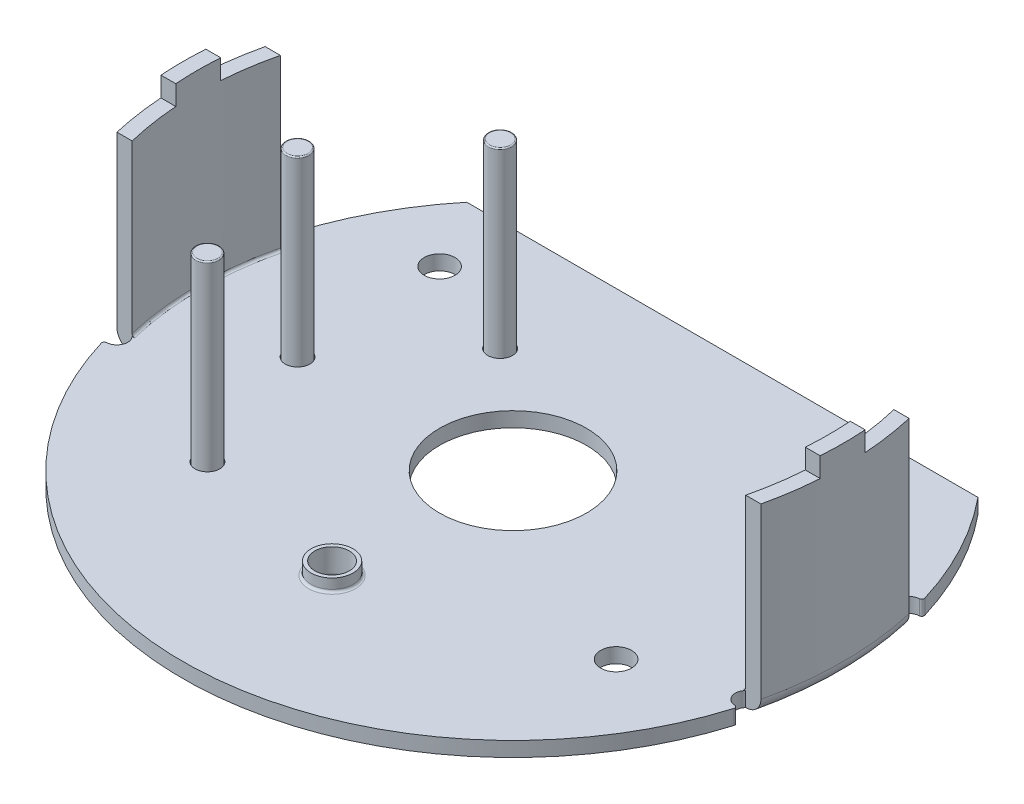
from build123d import *

# Parameters (mm, degrees)
SKETCH_1_R          = 13.375
EXTRUDE_1_DEPTH     = 7.85
SHELL_1_T           = -0.6
CUT_EXTRUDE_1_REACH = 22.479
CUT_EXTRUDE_2_DEPTH = 7.25
CUT_EXTRUDE_START   = -0.6
CUT_EXTRUDE_3_DEPTH = 0.6
FILLET_1_R          = 0.1
FILLET_2_R          = 0.6
FILLET_3_R          = 0.1
SKETCH_5_R          = 2.975
SKETCH_5_R_2        = 0.6250000000000007
SKETCH_5_R_3        = 0.5000000000000009
SKETCH_5_R_4        = 0.5000000000000008
SKETCH_5_R_5        = 0.5000000000000017
SKETCH_5_R_6        = 0.7
CUT_EXTRUDE_4_DEPTH = 0.6
SKETCH_6_R          = 1.1
CUT_EXTRUDE_5_DEPTH = 0.1
SKETCH_7_R          = 0.47499999999999953
EXTRUDE_2_DEPTH     = 7.95
SKETCH_7_R_2        = 0.47500000000000037
EXTRUDE_2_2_DEPTH   = 7.95
SKETCH_7_R_3        = 0.47499999999999964
EXTRUDE_2_3_DEPTH   = 7.95
FILLET_4_R          = 0.05
FILLET_5_R          = 0.05
FILLET_6_R          = 0.05
SKETCH_8_W          = 26.750000000000004
SKETCH_8_H          = 2.19
CUT_EXTRUDE_6_DEPTH = 0.4
EXTRUDE_3_DEPTH     = 0.4
EXTRUDE_START       = 0.5
SKETCH_10_R         = 0.8499999999999993
SKETCH_10_R_2       = 0.6999999999999993
EXTRUDE_4_DEPTH     = 0.5
FILLET_7_R          = 0.15
FILLET_8_R          = 0.1


with BuildPart() as part:
    # Эскиз1 → Бобышка-Вытянуть1 (new body)
    with BuildSketch(Plane(origin=(0, 0, 0), x_dir=(1, 0, 0), z_dir=(0, 1, 0))):
        with Locations(Location((0, 0, 0), (0, 0, 270))):
            Circle(SKETCH_1_R)
    extrude(amount=EXTRUDE_1_DEPTH)

    # Оболочка1
    shell_1_openings = [part.faces().sort_by_distance(p)[0] for p in [
        (0, 7.85, 0),
    ]]
    offset(amount=SHELL_1_T, openings=shell_1_openings, kind=Kind.INTERSECTION)

    # Вырез-Вытянуть1: up to this face of the body (flat: up to its plane)
    cut_extrude_1_end = Plane(part.part.faces().sort_by_distance((0, 0, 0))[0])
    # Эскиз2 → Вырез-Вытянуть1 (cut, up to the picked face)
    with BuildSketch(Plane(origin=(0, 7.85, 0), x_dir=(1, 0, 0), z_dir=(0, 1, 0)), mode=Mode.PRIVATE) as cut_extrude_1_sk1:
        Polygon((-13.375, 14), (13.375, 14.000000000000004), (13.375000000000002, 8.475000000000001), (-13.375000000000002, 8.474999999999998), align=None)
    cut_extrude_1_tool1 = split(extrude(cut_extrude_1_sk1.sketch, amount=-CUT_EXTRUDE_1_REACH, mode=Mode.PRIVATE), bisect_by=cut_extrude_1_end, keep=Keep.BOTH, mode=Mode.PRIVATE)
    add(cut_extrude_1_tool1.solids().sort_by(Axis((0, 7.85, -11.2375), (0, -1, 0)))[0], mode=Mode.SUBTRACT)

    # Эскиз3 → Вырез-Вытянуть2 (cut)
    with BuildSketch(Plane(origin=(0, 7.85, 0), x_dir=(1, 0, 0), z_dir=(0, 1, 0))):
        Polygon((-13.375000000000002, 9.474999999999998), (13.375000000000002, 9.475000000000001), (13.374999999999998, 3.0000000000000036), (-13.374999999999998, 3), align=None)
        Polygon((-13.374999999999998, -3), (13.374999999999998, -2.9999999999999964), (13.375, -14.374999999999995), (-13.374999999999996, -14.374999999999998), align=None)
    extrude(amount=-CUT_EXTRUDE_2_DEPTH, mode=Mode.SUBTRACT)

    # Эскиз4 → Вырез-Вытянуть3 (cut)
    with BuildSketch(Plane(origin=(0, 0.6, 0), x_dir=(1, 0, 0), z_dir=(0, 1, 0)).offset(CUT_EXTRUDE_START)):
        with BuildLine():
            Line((-13.034209795764374, -3), (-12.417754426626418, -3))
            ThreePointArc((-12.417754426626418, -3), (-12.359474669780546, -3.5229744066257926), (-12.846906012793687, -3.72124050532151))
            ThreePointArc((-12.846906012793687, -3.72124050532151), (-12.945581711171867, -3.3619249187589606), (-13.034209795764374, -3))
        make_face()
        with BuildLine():
            Line((-13.034209795764374, 3), (-12.417754426626418, 3))
            ThreePointArc((-12.417754426626418, 3), (-12.359474669780546, 3.5229744066257926), (-12.846906012793687, 3.7212405053215094))
            ThreePointArc((-12.846906012793687, 3.7212405053215094), (-12.94558171117187, 3.3619249187589615), (-13.034209795764374, 3))
        make_face()
    cut_extrude_3 = extrude(amount=CUT_EXTRUDE_3_DEPTH, mode=Mode.SUBTRACT)

    # Зеркальное отражение1: Вырез-Вытянуть3 across plane
    add(cut_extrude_3.mirror(Plane(origin=(0, 0, 0), x_dir=(0, 0, 1), z_dir=(1, 0, 0))), mode=Mode.SUBTRACT)

    # Скругление1
    fillet_1_edges = [part.edges().sort_by_distance(p)[0] for p in [
        (12.846906012793685, 0.3, -3.7212405053215094),
        (12.846906012793688, 0.3, 3.7212405053215107),
        (-12.846906012793685, 0.3, -3.7212405053215094),
        (-12.846906012793688, 0.3, 3.7212405053215107),
    ]]
    fillet(fillet_1_edges, radius=FILLET_1_R)

    # Скругление2
    fillet_2_edges = [part.edges().sort_by_distance(p)[0] for p in [
        (-13.375, 0, 0),
        (13.375, 0, -5.33e-15),
    ]]
    fillet(fillet_2_edges, radius=FILLET_2_R)

    # Скругление3
    fillet_3_edges = [part.edges().sort_by_distance(p)[0] for p in [
        (-12.775, 0.6, 6.306e-14),
        (12.775, 0.6, 5.596e-14),
    ]]
    fillet(fillet_3_edges, radius=FILLET_3_R)

    # Эскиз5 → Вырез-Вытянуть4 (cut)
    with BuildSketch(Plane(origin=(0, 0.6, 0), x_dir=(1, 0, 0), z_dir=(0, 1, 0))):
        with Locations(Location((0, 0, 0), (0, 0, 270))):
            Circle(SKETCH_5_R)
        with Locations(Location((-8.64722184936614, 5.674999999999998, 0), (0, 0, 270))):
            Circle(SKETCH_5_R_2)
        with Locations(Location((-4.5472218493661405, 4.024999999999999, 0), (0, 0, 270))):
            Circle(SKETCH_5_R_3)
        with Locations(Location((-8.34722184936614, -0.37500000000000205, 0), (0, 0, 270))):
            Circle(SKETCH_5_R_4)
        with Locations(Location((-6.49722184936614, -5.875000000000002, 0), (0, 0, 270))):
            Circle(SKETCH_5_R_5)
        with Locations(Location((0, -7.325000000000004, 0), (0, 0, 270))):
            Circle(SKETCH_5_R_6)
        with Locations(Location((8.697221849366136, -4.525000000000001, 0), (0, 0, 270))):
            Circle(SKETCH_5_R_2)
    extrude(amount=-CUT_EXTRUDE_4_DEPTH, mode=Mode.SUBTRACT)

    # Эскиз6 → Вырез-Вытянуть5 (cut)
    with BuildSketch(Plane.XZ):
        with Locations(Location((-6.49722184936614, 5.875000000000002, 0), (0, 0, 270))):
            Circle(SKETCH_6_R)
        with Locations(Location((-8.34722184936614, 0.37500000000000205, 0), (0, 0, 270))):
            Circle(SKETCH_6_R)
        with Locations(Location((-4.5472218493661405, -4.024999999999999, 0), (0, 0, 270))):
            Circle(SKETCH_6_R)
    extrude(amount=-CUT_EXTRUDE_5_DEPTH, mode=Mode.SUBTRACT)

    # Эскиз8 → Вырез-Вытянуть6 (cut)
    with BuildSketch(Plane(origin=(0, 7.85, 0), x_dir=(1, 0, 0), z_dir=(0, 1, 0))):
        with Locations((0, 2.005)):
            Rectangle(SKETCH_8_W, SKETCH_8_H)
        Polygon((-13.375, -0.91), (13.375, -0.9099999999999967), (13.375, -3.0999999999999965), (-13.375, -3.1), align=None)
    extrude(amount=-CUT_EXTRUDE_6_DEPTH, mode=Mode.SUBTRACT)

    # Эскиз9 → Бобышка-Вытянуть3 (add)
    with BuildSketch(Plane(origin=(0, 7.85, 0), x_dir=(1, 0, 0), z_dir=(0, 1, 0))):
        with BuildLine():
            Line((-13.344007081832654, -0.91), (-12.742547822158643, -0.9099999999999999))
            ThreePointArc((-12.742547822158643, -0.9099999999999999), (-12.775, 1.56e-15), (-12.742547822158643, 0.9100000000000001))
            Line((-12.742547822158643, 0.9100000000000001), (-13.344007081832654, 0.91))
            ThreePointArc((-13.344007081832654, 0.91), (-13.375, 1.64e-15), (-13.344007081832654, -0.91))
        make_face()
        with BuildLine():
            Line((12.742547822158643, -0.9099999999999968), (13.344007081832656, -0.9099999999999967))
            ThreePointArc((13.344007081832656, -0.9099999999999967), (13.375000000000002, -5.6e-16), (13.344007081832657, 0.9099999999999956))
            Line((13.344007081832657, 0.9099999999999956), (12.742547822158643, 0.91))
            ThreePointArc((12.742547822158643, 0.91), (12.774999999999999, 1.6e-15), (12.742547822158643, -0.9099999999999968))
        make_face()
    extrude(amount=EXTRUDE_3_DEPTH)

    # Эскиз10 → Бобышка-Вытянуть4 (add)
    with BuildSketch(Plane(origin=(0, 0.6, 0), x_dir=(1, 0, 0), z_dir=(0, 1, 0)).offset(EXTRUDE_START)):
        with Locations(Location((0, -7.325000000000004, 0), (0, 0, 270))):
            Circle(SKETCH_10_R)
        with Locations(Location((0, -7.325000000000004, 0), (0, 0, 270))):
            Circle(SKETCH_10_R_2, mode=Mode.SUBTRACT)
    extrude(amount=-EXTRUDE_4_DEPTH)

    # Скругление7
    fillet_7_edges = [part.edges().sort_by_distance(p)[0] for p in [
        (2.1e-16, 0, 6.6250000000000036),
    ]]
    fillet(fillet_7_edges, radius=FILLET_7_R)

    # Скругление8
    fillet_8_edges = [part.edges().sort_by_distance(p)[0] for p in [
        (2.6e-16, 0.6, 6.475000000000004),
    ]]
    fillet(fillet_8_edges, radius=FILLET_8_R)


with BuildPart() as body_2:
    # Эскиз7 → Бобышка-Вытянуть2 (new body)
    with BuildSketch(Plane.XZ):
        with Locations(Location((-6.49722184936614, 5.875000000000002, 0), (0, 0, 270))):
            Circle(SKETCH_7_R)
    extrude(amount=-EXTRUDE_2_DEPTH)

    # Скругление6
    fillet_6_edges = [body_2.edges().sort_by_distance(p)[0] for p in [
        (-6.49722184936614, 0, 6.350000000000001),
        (-6.49722184936614, 7.95, 6.350000000000001),
    ]]
    fillet(fillet_6_edges, radius=FILLET_6_R)


with BuildPart() as body_3:
    # Эскиз7 → Extrude 2 2 (new body)
    with BuildSketch(Plane.XZ):
        with Locations(Location((-8.34722184936614, 0.37500000000000205, 0), (0, 0, 270))):
            Circle(SKETCH_7_R_2)
    extrude(amount=-EXTRUDE_2_2_DEPTH)

    # Скругление5
    fillet_5_edges = [body_3.edges().sort_by_distance(p)[0] for p in [
        (-8.34722184936614, 0, 0.8500000000000024),
        (-8.34722184936614, 7.95, 0.8500000000000024),
    ]]
    fillet(fillet_5_edges, radius=FILLET_5_R)


with BuildPart() as body_4:
    # Эскиз7 → Extrude 2 3 (new body)
    with BuildSketch(Plane.XZ):
        with Locations(Location((-4.5472218493661405, -4.024999999999999, 0), (0, 0, 270))):
            Circle(SKETCH_7_R_3)
    extrude(amount=-EXTRUDE_2_3_DEPTH)

    # Скругление4
    fillet_4_edges = [body_4.edges().sort_by_distance(p)[0] for p in [
        (-4.5472218493661405, 0, -3.549999999999999),
        (-4.5472218493661405, 7.95, -3.549999999999999),
    ]]
    fillet(fillet_4_edges, radius=FILLET_4_R)


solid = Compound([part.part, body_2.part, body_3.part, body_4.part])
